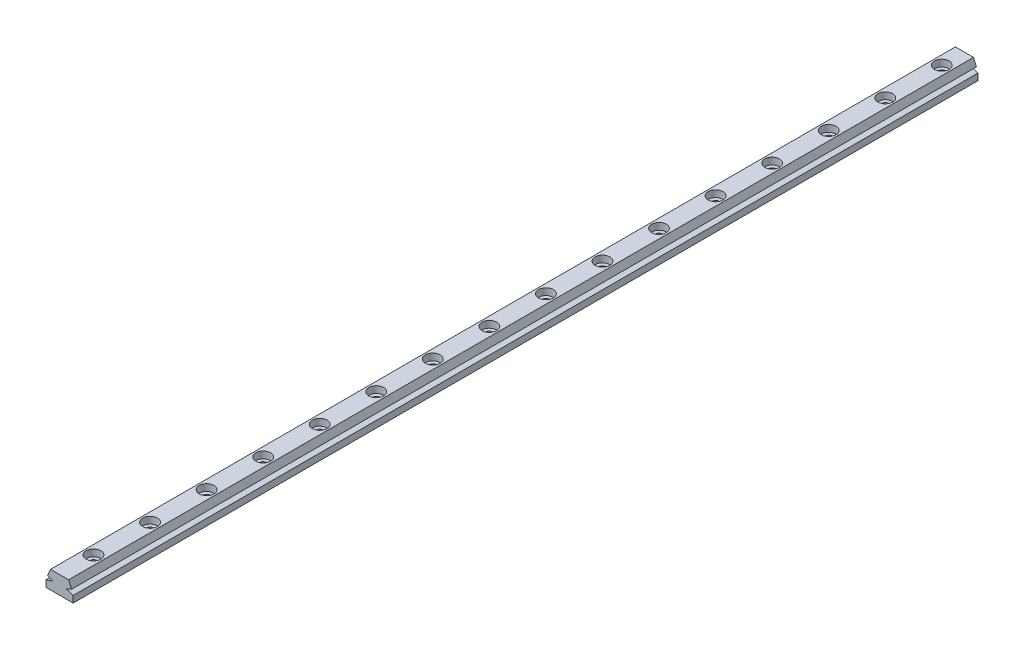
from build123d import *

# Parameters (mm, degrees)
EXTRUDE_1_DEPTH              = 400
HOLE_WIZARD_M3_1_D           = 3.4
HOLE_WIZARD_M3_1_CBORE_D     = 6.5
HOLE_WIZARD_M3_1_CBORE_DEPTH = 3


with BuildPart() as part:
    # 草图1 → 凸台-拉伸1 (new body)
    with BuildSketch(Plane(origin=(0, 0, 0), x_dir=(-1, 0, 0), z_dir=(0, 0, -1))):
        Polygon((-4, 4.958168347), (-5.3, 1.958168347), (-3, 0.958168347), (-6, -0.041831653), (-6, -2.974901007), (6, -2.974901007), (6, -0.041831653), (3, 0.958168347), (5.3, 1.958168347), (4, 4.958168347), align=None)
    extrude(amount=-EXTRUDE_1_DEPTH)

    # M3 六角头机械螺钉的柱形沉头孔1 (through all)
    with Locations(Plane(origin=(0, 4.958168347, 0), x_dir=(1, 0, 0), z_dir=(0, 1, 0))):
        with Locations((0, -385), (0, -360), (0, -335), (0, -310), (0, -285), (0, -260), (0, -235), (0, -210), (0, -185), (0, -160), (0, -135), (0, -110), (0, -85), (0, -60), (0, -10), (0, -35)):
            CounterBoreHole(HOLE_WIZARD_M3_1_D / 2, HOLE_WIZARD_M3_1_CBORE_D / 2, HOLE_WIZARD_M3_1_CBORE_DEPTH)


solid = part.part
